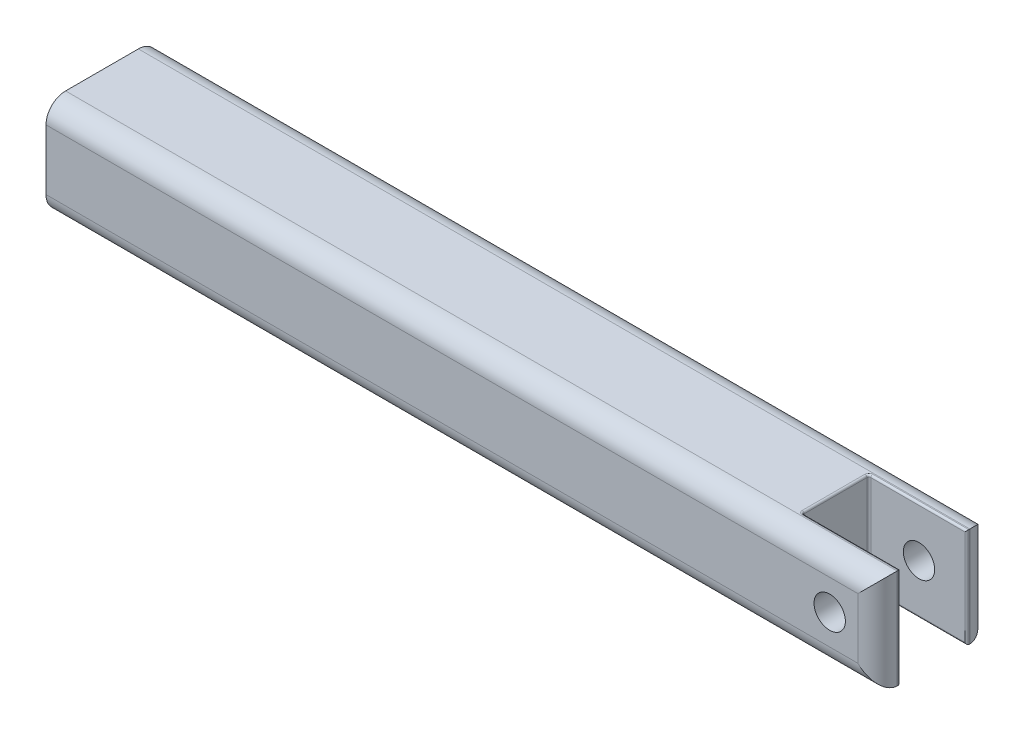
from build123d import *

# Parameters (mm, degrees)
SKETCH1_W               = 212.2
SKETCH1_H               = 25.4
BOSS_EXTRUDE1_DEPTH     = 14.2875
CUT_EXTRUDE2_DEPTH      = 108.808314412
CUT_EXTRUDE2_DEPTH_BACK = 108.808314412
SKETCH2_R               = 4
CUT_EXTRUDE3_DEPTH      = 108.808314412
CUT_EXTRUDE3_DEPTH_BACK = 108.808314412
SKETCH3_W               = 25
SKETCH3_H               = 17
FILLET3_R               = 5
FILLET4_R               = 0.5


with BuildPart() as part:
    # Sketch1 → Boss-Extrude1 (new, symmetric)
    with BuildSketch(Plane.XY):
        Rectangle(SKETCH1_W, SKETCH1_H)
    extrude(amount=BOSS_EXTRUDE1_DEPTH, both=True)

    # Sketch2 → Cut-Extrude2 (cut, two sides: drawn at the far end of the back side and taken through both)
    with BuildSketch(Plane.XY.offset(-CUT_EXTRUDE2_DEPTH_BACK)):
        with Locations((93.9, 0)):
            Circle(SKETCH2_R)
    extrude(amount=CUT_EXTRUDE2_DEPTH + CUT_EXTRUDE2_DEPTH_BACK, mode=Mode.SUBTRACT)

    # Sketch3 → Cut-Extrude3 (cut, two sides: drawn at the far end of the back side and taken through both)
    with BuildSketch(Plane(origin=(0, 0, 0), x_dir=(1, 0, 0), z_dir=(0, 1, 0)).offset(-CUT_EXTRUDE3_DEPTH_BACK)):
        with Locations((93.6, 0)):
            Rectangle(SKETCH3_W, SKETCH3_H)
    extrude(amount=CUT_EXTRUDE3_DEPTH + CUT_EXTRUDE3_DEPTH_BACK, mode=Mode.SUBTRACT)

    # Fillet3
    fillet3_edges = [part.edges().sort_by_distance(p)[0] for p in [
        (106.1, 0, 14.2875),
        (0, 12.7, 14.2875),
        (0, 12.7, -14.2875),
        (106.1, 0, -14.2875),
        (0, -12.7, -14.2875),
        (0, -12.7, 14.2875),
    ]]
    fillet(fillet3_edges, radius=FILLET3_R)

    # Fillet4
    fillet4_edges = [part.edges().sort_by_distance(p)[0] for p in [
        (106.1, 0, 8.5),
        (93.6, -12.7, 8.5),
        (81.1, 0, -8.5),
        (93.6, -12.7, -8.5),
        (106.1, 0, -8.5),
        (81.1, 0, 8.5),
        (81.1, -12.7, 0),
        (93.6, 12.7, -8.5),
        (81.1, 12.7, 0),
        (93.6, 12.7, 8.5),
    ]]
    fillet(fillet4_edges, radius=FILLET4_R)


solid = part.part
